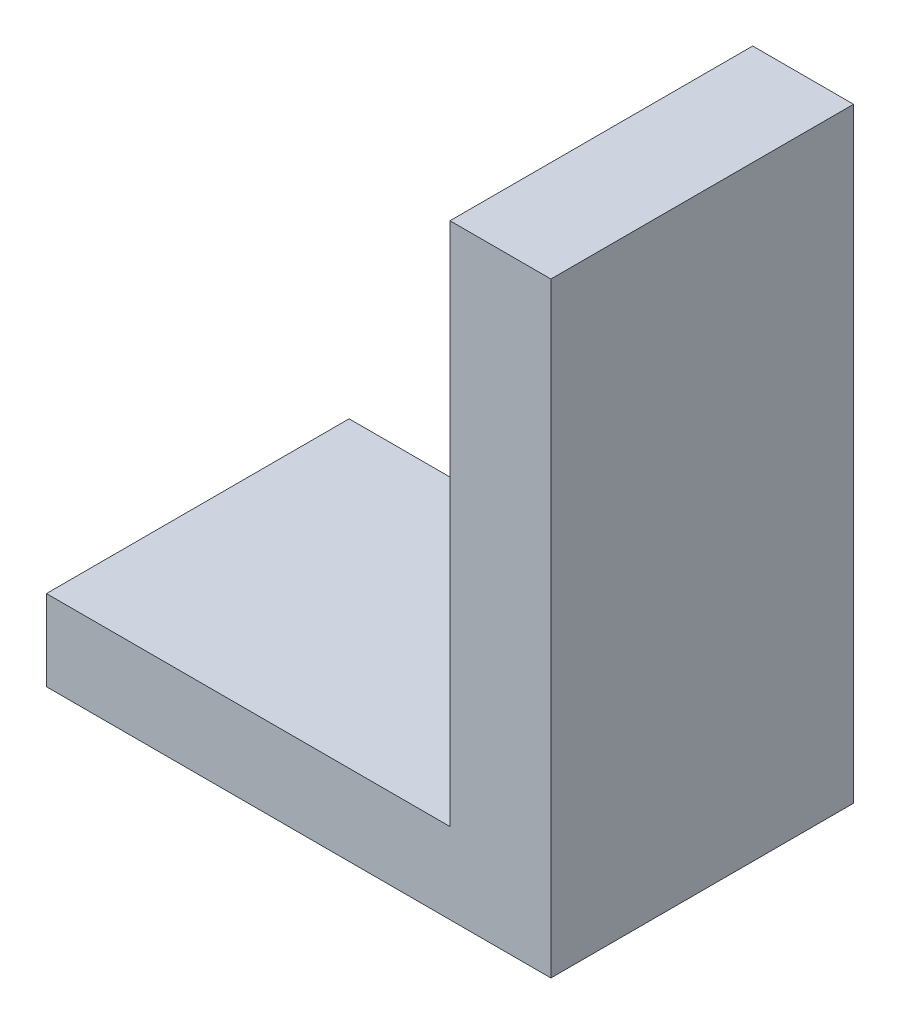
from build123d import *

# Parameters (mm, degrees)
ANGULO_L_DEPTH             = 37.5
CROQUIS_AGUJEROS_MONTAJE_R = 5
AGUJERO_INSERTO_M6_DEPTH   = 14


with BuildPart() as part:
    # Croquis_perfil_L → Angulo_L (new, symmetric)
    with BuildSketch(Plane.XY):
        Polygon((-62.5, 0), (62.5, 0), (62.5, 150), (37.5, 150), (37.5, 20), (-62.5, 20), align=None)
    extrude(amount=ANGULO_L_DEPTH, both=True)

    # Croquis_agujeros_montaje → Agujero_inserto_M6 (cut)
    with BuildSketch(Plane(origin=(0, 0, 0), x_dir=(1, 0, 0), z_dir=(0, 1, 0))):
        with Locations(Location((-50, 0, 0), (0, 0, 270))):
            Circle(CROQUIS_AGUJEROS_MONTAJE_R)
        with Locations(Location((0, 0, 0), (0, 0, 270))):
            Circle(CROQUIS_AGUJEROS_MONTAJE_R)
    extrude(amount=AGUJERO_INSERTO_M6_DEPTH, mode=Mode.SUBTRACT)


solid = part.part
